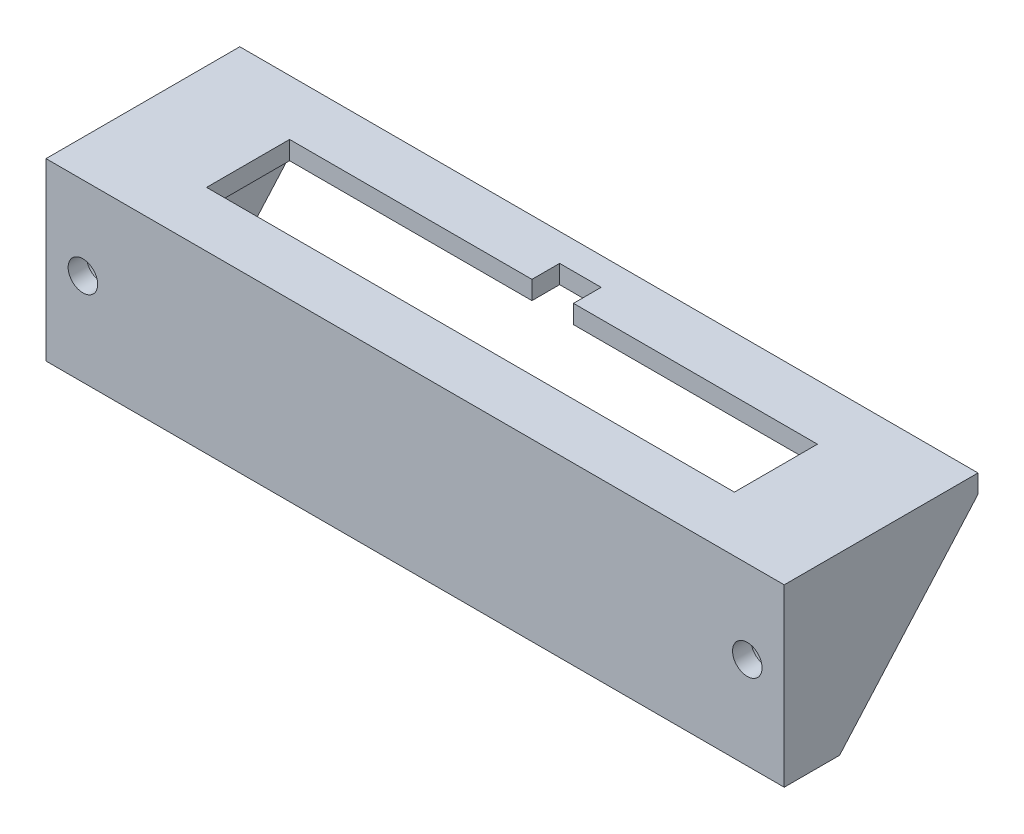
from build123d import *

# Parameters (mm, degrees)
SKETCH1_W           = 80
SKETCH1_H           = 21
BOSS_EXTRUDE1_DEPTH = 2
BOSS_EXTRUDE2_DEPTH = 8
SKETCH3_R           = 1.6
CUT_EXTRUDE1_DEPTH  = 59.625759514
CUT_EXTRUDE2_START  = 32.087294298
SKETCH3_5_R         = 3.1
SKETCH3_5_R_2       = 1.6
CUT_EXTRUDE2_DEPTH  = 32.087294298
SKETCH4_W           = 64
SKETCH4_H           = 6
BOSS_EXTRUDE5_DEPTH = 17


with BuildPart() as part:
    # Sketch1 → Boss-Extrude1 (new body)
    with BuildSketch(Plane(origin=(0, 12.25, 0), x_dir=(1, 0, 0), z_dir=(0, 1, 0))):
        with Locations((5.518936126, -23.587294298)):
            Rectangle(SKETCH1_W, SKETCH1_H)
        Polygon((-23.081063874, -28.087294298), (34.118936126, -28.087294298), (34.118936126, -19.087294298), (7.681087054, -19.087294298), (7.681087054, -16.087294298), (3.181087054, -16.087294298), (3.181087054, -19.087294298), (-23.081063874, -19.087294298), align=None, mode=Mode.SUBTRACT)
    extrude(amount=BOSS_EXTRUDE1_DEPTH)

    # Sketch2 → Boss-Extrude2 (add)
    with BuildSketch(Plane.ZY.offset(34.481063874)):
        Polygon((34.087294298, 12.25), (34.087294298, -4.75), (28.087294298, -4.75), (13.087294298, 12.25), align=None)
    boss_extrude2 = extrude(amount=-BOSS_EXTRUDE2_DEPTH)

    # Sketch3 → Cut-Extrude1 (cut, symmetric)
    with BuildSketch(Plane.XY):
        with Locations(Location((-30.481063874, 5.25, 0), (0, 0, 90))):
            Circle(SKETCH3_R)
    cut_extrude1 = extrude(amount=CUT_EXTRUDE1_DEPTH, both=True, mode=Mode.SUBTRACT)

    # Sketch3<5> → Cut-Extrude2 (cut)
    with BuildSketch(Plane.XY.offset(CUT_EXTRUDE2_START)):
        with Locations(Location((-30.481063874, 5.25, 0), (0, 0, 180))):
            Circle(SKETCH3_5_R)
        with Locations(Location((-30.481063874, 5.25, 0), (0, 0, 180))):
            Circle(SKETCH3_5_R_2, mode=Mode.SUBTRACT)
    cut_extrude2 = extrude(amount=-CUT_EXTRUDE2_DEPTH, mode=Mode.SUBTRACT)

    # Mirror1: Boss-Extrude2, Cut-Extrude1, Cut-Extrude2 across plane
    add(boss_extrude2.mirror(Plane.ZY.offset(-5.518936126)))
    add(cut_extrude1.mirror(Plane.ZY.offset(-5.518936126)), mode=Mode.SUBTRACT)
    add(cut_extrude2.mirror(Plane.ZY.offset(-5.518936126)), mode=Mode.SUBTRACT)

    # Sketch4 → Boss-Extrude5 (add)
    with BuildSketch(Plane.XZ.offset(-12.25)):
        with Locations((5.518936126, 31.087294298)):
            Rectangle(SKETCH4_W, SKETCH4_H)
    extrude(amount=BOSS_EXTRUDE5_DEPTH)


solid = part.part
